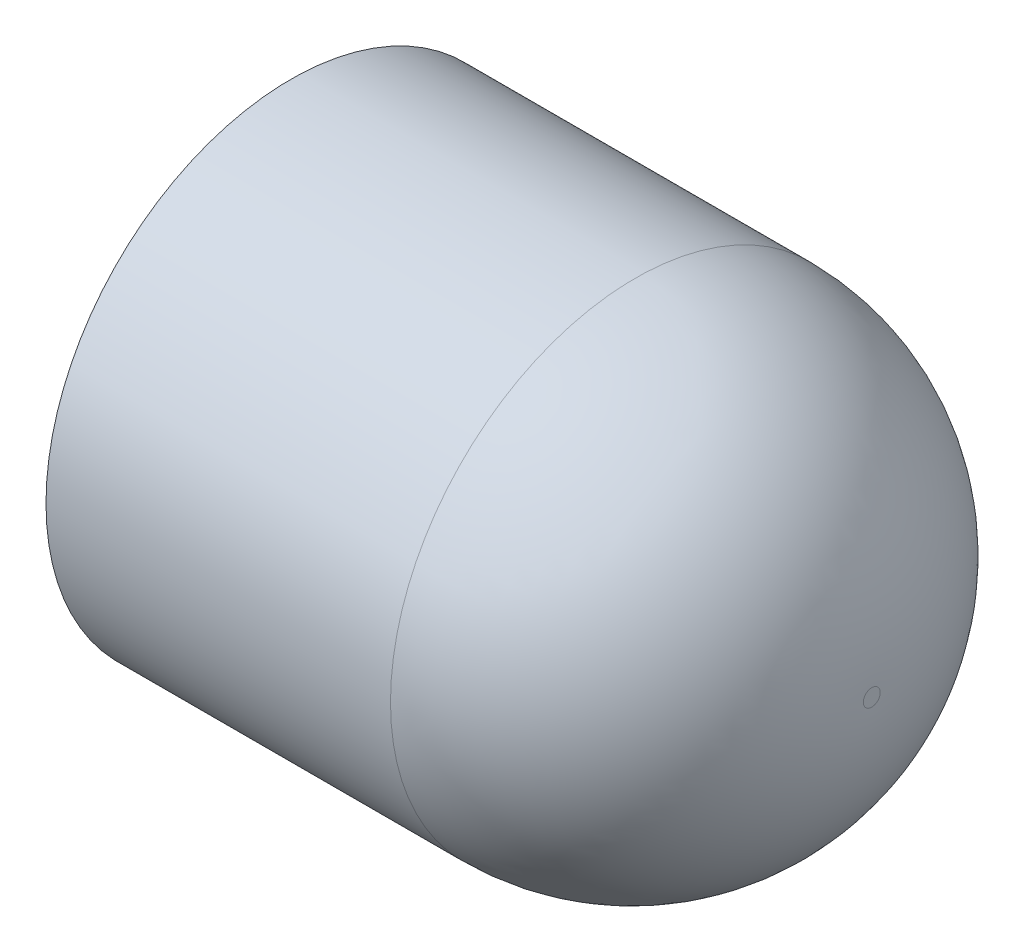
from build123d import *


with BuildPart() as part:
    # Sketch1 → Revolve1 (revolve)
    with BuildSketch(Plane(origin=(0, 0, 0), x_dir=(1, 0, 0), z_dir=(0, 1, 0)), mode=Mode.PRIVATE) as revolve1_sk:
        with BuildLine():
            Line((0, 0), (21.844, 0))
            Line((21.844, 0), (21.844, 0.3175))
            ThreePointArc((21.844, 0.3175), (19.240179285, 6.603679285), (12.954, 9.2075))
            Line((12.954, 9.2075), (0, 9.2075))
            Line((0, 9.2075), (0, 0))
        make_face()
    revolve(revolve1_sk.sketch.rotate(Axis((0, 0, 0), (1, 0, 0)), 180), axis=Axis((0, 0, 0), (1, 0, 0)))


solid = part.part
